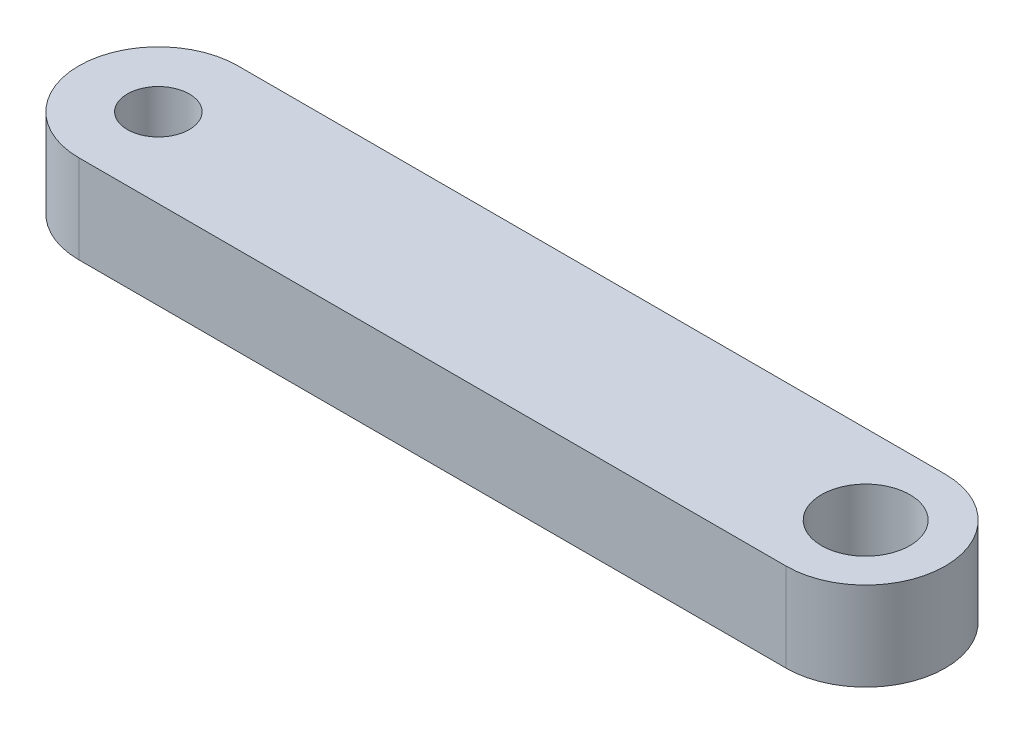
from build123d import *

# Parameters (mm, degrees)
BOSS_EXTRUDE1_DEPTH = 5
SKETCH2_R           = 1.75
CUT_EXTRUDE1_DEPTH  = 5
SKETCH5_R           = 2.5
CUT_EXTRUDE2_DEPTH  = 10


with BuildPart() as part:
    # Sketch1 → Boss-Extrude1 (new body)
    with BuildSketch(Plane(origin=(0, 0, 0), x_dir=(1, 0, 0), z_dir=(0, 1, 0))):
        with BuildLine():
            Line((0, 4.5), (40, 4.5))
            ThreePointArc((40, 4.5), (44.5, 0), (40, -4.5))
            Line((40, -4.5), (0, -4.5))
            ThreePointArc((0, -4.5), (-4.5, 0), (0, 4.5))
        make_face()
    extrude(amount=BOSS_EXTRUDE1_DEPTH)

    # Sketch2 → Cut-Extrude1 (cut)
    with BuildSketch(Plane(origin=(0, 5, 0), x_dir=(1, 0, 0), z_dir=(0, 1, 0))):
        with Locations(Location((0, 0, 0), (0, 0, 270))):
            Circle(SKETCH2_R)
    extrude(amount=-CUT_EXTRUDE1_DEPTH, mode=Mode.SUBTRACT)

    # Sketch5 → Cut-Extrude2 (cut)
    with BuildSketch(Plane(origin=(0, 5, 0), x_dir=(1, 0, 0), z_dir=(0, 1, 0))):
        with Locations(Location((40, 0, 0), (0, 0, 270))):
            Circle(SKETCH5_R)
    extrude(amount=-CUT_EXTRUDE2_DEPTH, mode=Mode.SUBTRACT)


solid = part.part
